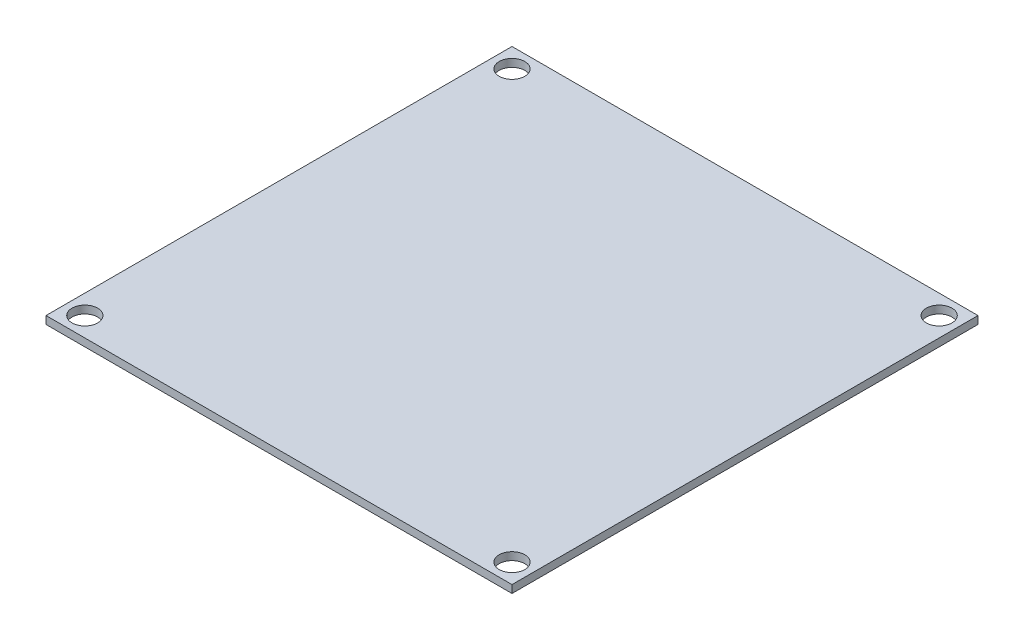
from build123d import *

# Parameters (mm, degrees)
CROQUIS1_W              = 60
CROQUIS1_H              = 60
SALIENTE_EXTRUIR1_DEPTH = 1
CROQUIS3_R              = 1.65
CORTAR_EXTRUIR1_DEPTH   = 43.438190348


with BuildPart() as part:
    # Croquis1 → Saliente-Extruir1 (new body)
    with BuildSketch(Plane(origin=(0, 0, 0), x_dir=(1, 0, 0), z_dir=(0, 1, 0))):
        Rectangle(CROQUIS1_W, CROQUIS1_H)
    extrude(amount=SALIENTE_EXTRUIR1_DEPTH)

    # Croquis3 → Cortar-Extruir1 (cut, through all)
    with BuildSketch(Plane(origin=(0, 1, 0), x_dir=(1, 0, 0), z_dir=(0, 1, 0))):
        with Locations(Location((-27.5, 27.5, 0), (0, 0, 270))):
            Circle(CROQUIS3_R)
        with Locations(Location((27.5, 27.5, 0), (0, 0, 270))):
            Circle(CROQUIS3_R)
        with Locations(Location((27.5, -27.5, 0), (0, 0, 270))):
            Circle(CROQUIS3_R)
        with Locations(Location((-27.5, -27.5, 0), (0, 0, 270))):
            Circle(CROQUIS3_R)
    extrude(amount=-CORTAR_EXTRUIR1_DEPTH, mode=Mode.SUBTRACT)


solid = part.part
